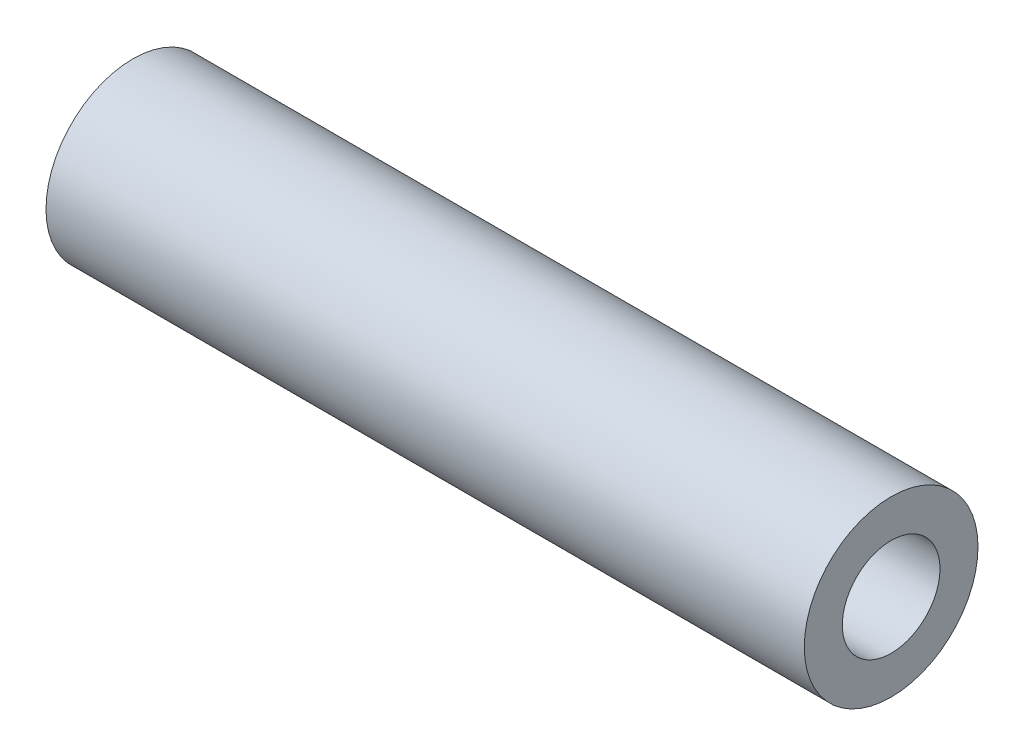
from build123d import *

# Parameters (mm, degrees)
SKETCH1_R           = 4
SKETCH1_R_2         = 2.25
BOSS_EXTRUDE1_DEPTH = 34.925


with BuildPart() as part:
    # Sketch1 → Boss-Extrude1 (new body)
    with BuildSketch(Plane(origin=(0, 0, 0), x_dir=(0, 0, -1), z_dir=(1, 0, 0))):
        Circle(SKETCH1_R)
        Circle(SKETCH1_R_2, mode=Mode.SUBTRACT)
    extrude(amount=BOSS_EXTRUDE1_DEPTH)


solid = part.part
